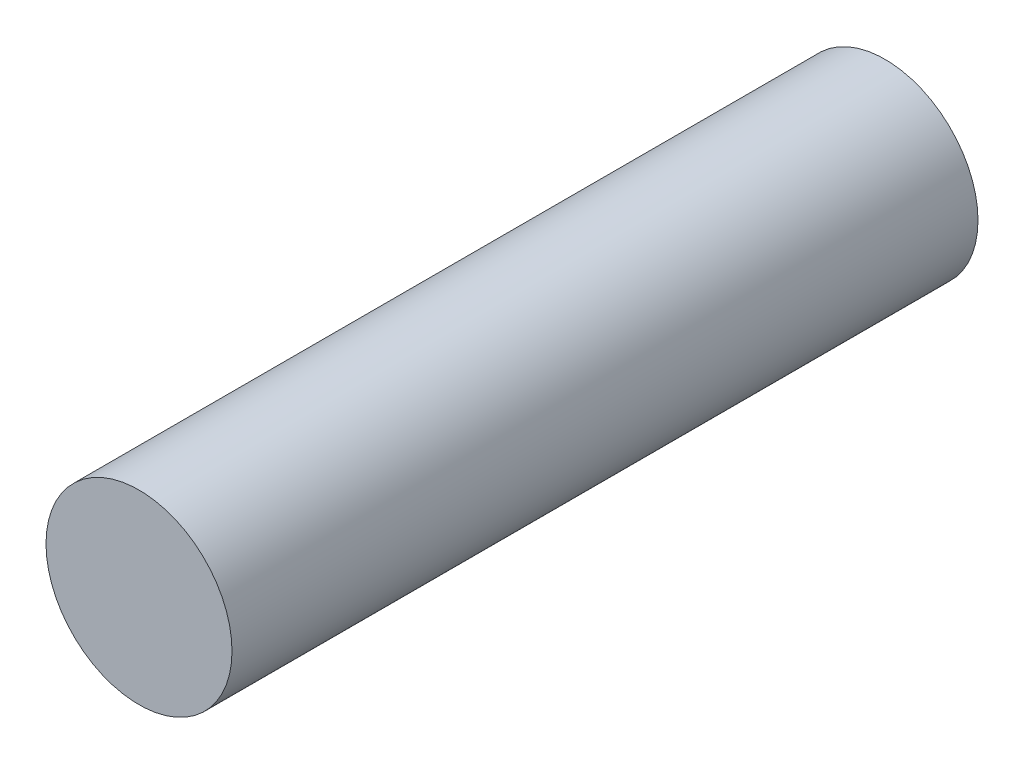
from build123d import *

# Parameters (mm, degrees)
SKETCH1_R           = 2.3749
BOSS_EXTRUDE1_DEPTH = 19.05


with BuildPart() as part:
    # Sketch1 → Boss-Extrude1 (new body)
    with BuildSketch(Plane.XY):
        with Locations(Location((-162.918245427, -13.576520452, 0), (0, 0, 180))):
            Circle(SKETCH1_R)
    extrude(amount=BOSS_EXTRUDE1_DEPTH)


solid = part.part
